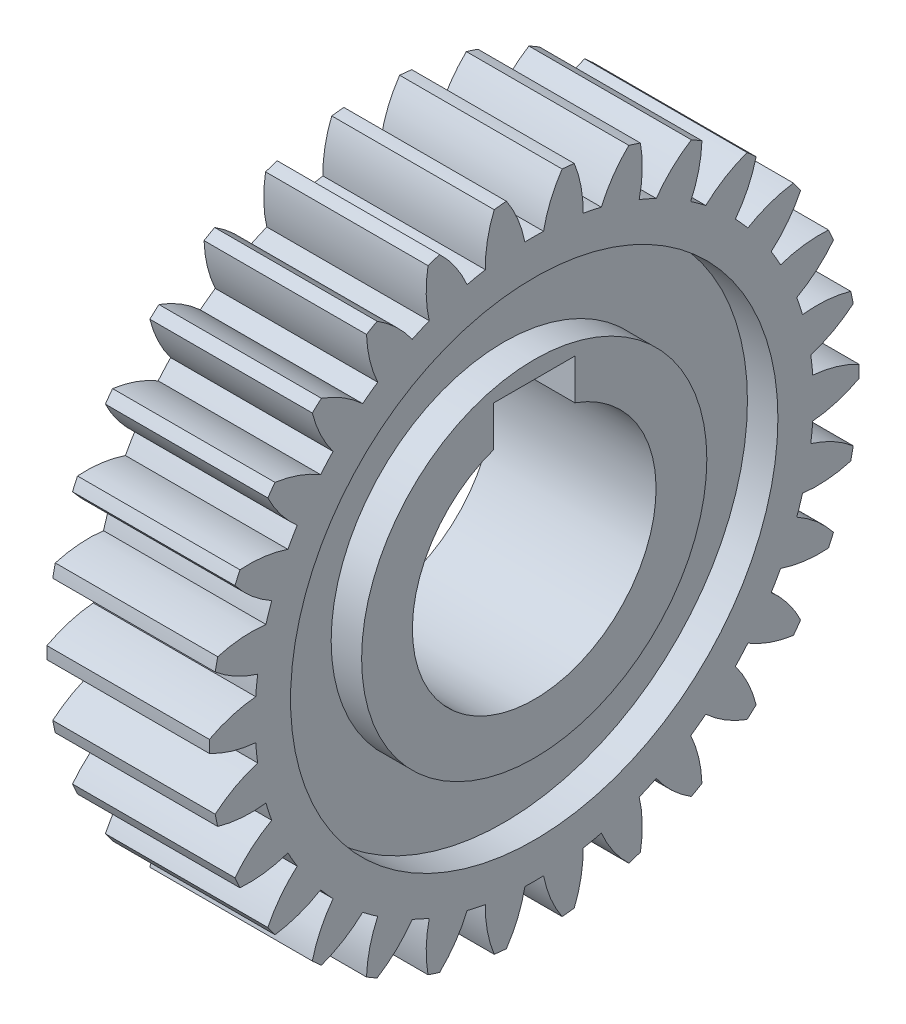
from build123d import *

# Parameters (mm, degrees)
BASPROSKE_W              = 16
BASPROSKE_H              = 32
TOOTHCUT_DEPTH           = 49
TEETHCUTS_COUNT          = 30
TEETHCUTS_ANGLE          = 348
BORSKE_R                 = 12
BORE_DEPTH               = 50.0000508
SCHIZZO3_R               = 24
SCHIZZO3_R_2             = 17
TAGLIO_ESTRUSIONE2_DEPTH = 3
TAGLIO_ESTRUSIONE3_DEPTH = 48.921417629


with BuildPart() as part:
    # BasProSke → Base-Revolve (revolve)
    with BuildSketch(Plane(origin=(0, 0, 0), x_dir=(1, 0, 0), z_dir=(0, 1, 0)), mode=Mode.PRIVATE) as base_revolve_sk:
        with Locations((8, 16)):
            Rectangle(BASPROSKE_W, BASPROSKE_H)
    revolve(base_revolve_sk.sketch.rotate(Axis((-10, 0, 0), (1, 0, 0)), 180), axis=Axis((-10, 0, 0), (1, 0, 0)))

    # TooCutSke → ToothCut (cut, through all)
    with BuildSketch(Plane(origin=(0, 0, 0), x_dir=(0, 0, -1), z_dir=(1, 0, 0))):
        with BuildLine():
            ThreePointArc((0.918551563, 27.483654488), (0, 27.499), (-0.918551563, 27.483654488))
            ThreePointArc((-0.918551563, 27.483654488), (-1.617208176, 29.787801627), (-2.761784709, 31.906093311))
            ThreePointArc((-2.761784709, 31.906093311), (0, 32.0254), (2.761784709, 31.906093311))
            ThreePointArc((2.761784709, 31.906093311), (1.617208176, 29.787801627), (0.918551563, 27.483654488))
        make_face()
    toothcut = extrude(amount=TOOTHCUT_DEPTH, mode=Mode.SUBTRACT)

    # TeethCuts: ToothCut ×30 about axis
    teethcuts_axis = Axis((-10, 0, 0), (1, 0, 0))
    for i in range(1, TEETHCUTS_COUNT):
        add(toothcut.rotate(teethcuts_axis, i * TEETHCUTS_ANGLE / (TEETHCUTS_COUNT - 1)), mode=Mode.SUBTRACT)

    # BorSke → Bore (cut, symmetric)
    with BuildSketch(Plane(origin=(0, 0, 0), x_dir=(0, 0, -1), z_dir=(1, 0, 0))):
        with Locations(Location((0, 0, 0), (0, 0, 180))):
            Circle(BORSKE_R)
    extrude(amount=BORE_DEPTH, both=True, mode=Mode.SUBTRACT)

    # Schizzo3 → Taglio-Estrusione2 (cut)
    with BuildSketch(Plane(origin=(16, 0, 0), x_dir=(0, 0, -1), z_dir=(1, 0, 0))):
        Circle(SCHIZZO3_R)
        Circle(SCHIZZO3_R_2, mode=Mode.SUBTRACT)
    taglio_estrusione2 = extrude(amount=-TAGLIO_ESTRUSIONE2_DEPTH, mode=Mode.SUBTRACT)

    # Specchia1: Taglio-Estrusione2 across plane
    add(taglio_estrusione2.mirror(Plane.ZY.offset(-8)), mode=Mode.SUBTRACT)

    # Schizzo4 → Taglio-Estrusione3 (cut, through all)
    with BuildSketch(Plane.ZY):
        with BuildLine():
            Line((-4, 15.3), (4, 15.3))
            Line((4, 15.3), (4, 11.313708499))
            ThreePointArc((4, 11.313708499), (0, 12), (-4, 11.313708499))
            Line((-4, 11.313708499), (-4, 15.3))
        make_face()
    extrude(amount=-TAGLIO_ESTRUSIONE3_DEPTH, mode=Mode.SUBTRACT)


solid = part.part
